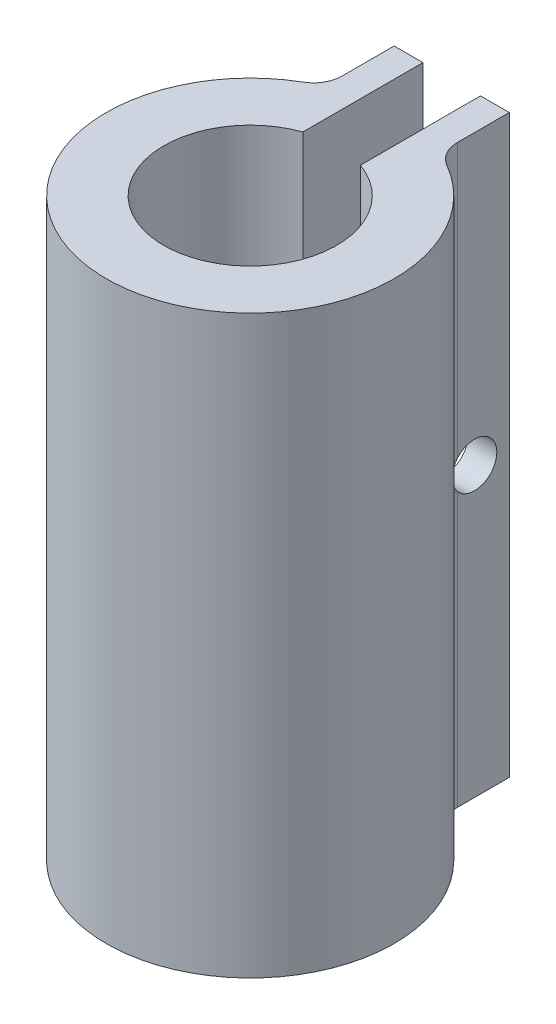
from build123d import *

# Parameters (mm, degrees)
BOSS_EXTRUDE4_DEPTH = 40
SKETCH2_R           = 1.55
CUT_EXTRUDE1_DEPTH  = 45.631827209
FILLET1_R           = 2


with BuildPart() as part:
    # Sketch1 → Boss-Extrude4 (new body)
    with BuildSketch(Plane(origin=(0, 0, 0), x_dir=(1, 0, 0), z_dir=(0, 1, 0))):
        with BuildLine():
            Line((-2, 14), (-4, 14))
            Line((-4, 14), (-4, 9.16515139))
            ThreePointArc((-4, 9.16515139), (0, -10), (4, 9.16515139))
            Line((4, 9.16515139), (4, 14))
            Line((4, 14), (2, 14))
            Line((2, 14), (2, 5.656854249))
            ThreePointArc((2, 5.656854249), (0, -6), (-2, 5.656854249))
            Line((-2, 5.656854249), (-2, 14))
        make_face()
    extrude(amount=BOSS_EXTRUDE4_DEPTH)

    # Sketch2 → Cut-Extrude1 (cut, through all)
    with BuildSketch(Plane(origin=(4, 0, 0), x_dir=(0, 0, -1), z_dir=(1, 0, 0))):
        with Locations((11.582575695, 20)):
            Circle(SKETCH2_R)
    extrude(amount=-CUT_EXTRUDE1_DEPTH, mode=Mode.SUBTRACT)

    # Fillet1
    fillet1_edges = [part.edges().sort_by_distance(p)[0] for p in [
        (4, 20, -9.16515139),
        (-4, 20, -9.16515139),
    ]]
    fillet(fillet1_edges, radius=FILLET1_R)


solid = part.part
